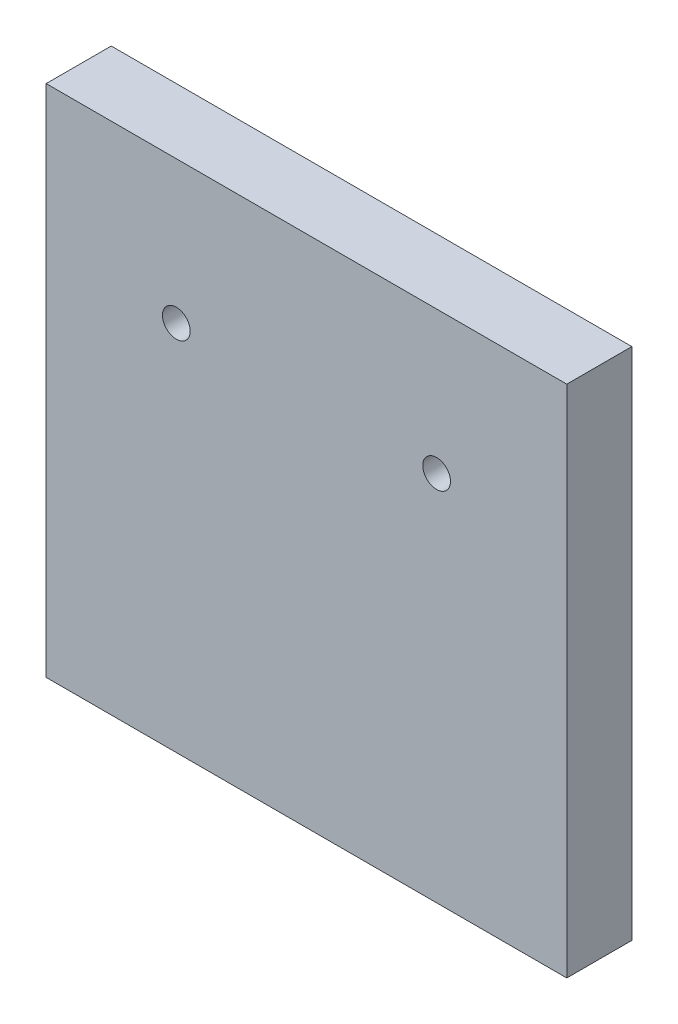
from build123d import *

# Parameters (mm, degrees)
SKETCH1_W             = 50.8
SKETCH1_H             = 50.184221981
BOSS_EXTRUDE1_DEPTH   = 6.35
F_6_32_TAPPED_HOLE1_D = 2.7051


with BuildPart() as part:
    # Sketch1 → Boss-Extrude1 (new body)
    with BuildSketch(Plane.XY):
        with Locations((0, -11.192110991)):
            Rectangle(SKETCH1_W, SKETCH1_H)
    extrude(amount=BOSS_EXTRUDE1_DEPTH)

    # #6-32 Tapped Hole1 (through all)
    with Locations(Plane(origin=(0, 0, 0), x_dir=(-1, 0, 0), z_dir=(0, 0, -1))):
        with Locations((-12.7, 0), (12.7, 0)):
            Hole(F_6_32_TAPPED_HOLE1_D / 2)


solid = part.part
